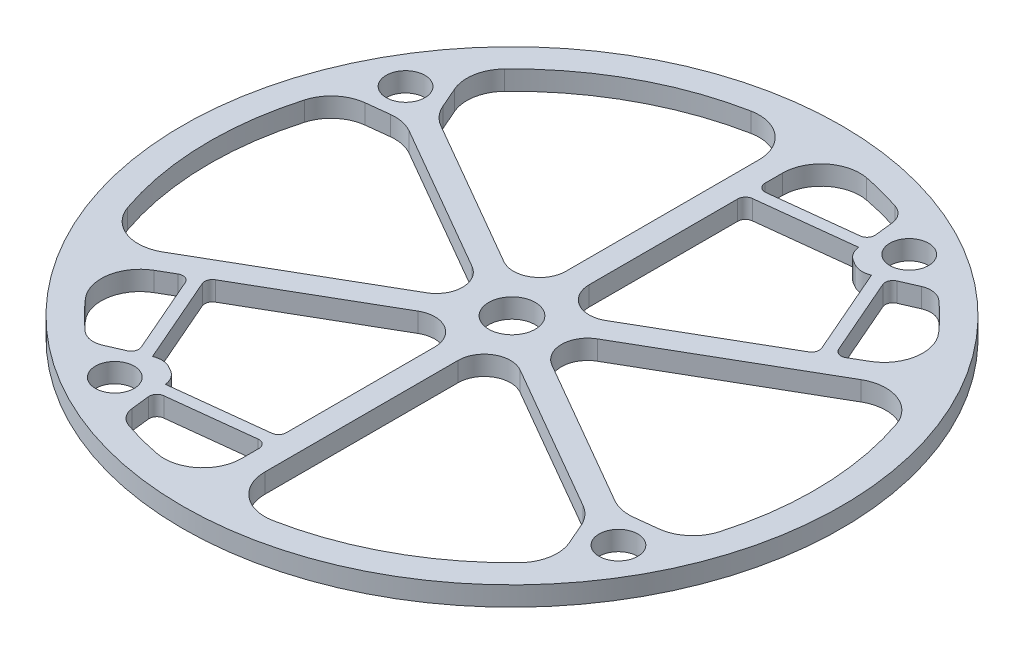
from build123d import *

# Parameters (mm, degrees)
SZKIC1_R                    = 85
DODANIE_WYCI_GNI_CIE1_DEPTH = 5
SZKIC2_R                    = 5
SZKIC2_R_2                  = 6
WYTNIJ_WYCI_GNI_CIE2_DEPTH  = 5
ZAOKR_GLENIE2_R             = 10
ZAOKR_GLENIE4_R             = 10
ZAOKR_GLENIE5_R             = 5
DODANIE_WYCI_GNI_CIE2_DEPTH = 5
ZAOKR_GLENIE6_R             = 2


with BuildPart() as part:
    # Szkic1 → Dodanie-wyciągnięcie1 (new body)
    with BuildSketch(Plane(origin=(0, 0, 0), x_dir=(1, 0, 0), z_dir=(0, 1, 0))):
        with Locations(Location((0, 0, 0), (0, 0, 270))):
            Circle(SZKIC1_R)
    extrude(amount=DODANIE_WYCI_GNI_CIE1_DEPTH)

    # Szkic2 → Wytnij-wyciągnięcie2 (cut)
    with BuildSketch(Plane(origin=(0, 5, 0), x_dir=(1, 0, 0), z_dir=(0, 1, 0))):
        with BuildLine():
            Line((3, 77.942286341), (3, 16.907164233))
            ThreePointArc((3, 16.907164233), (6.38067791, 11.051658328), (13.142033731, 11.051658328))
            Line((13.142033731, 11.051658328), (66, 41.569219382))
            ThreePointArc((66, 41.569219382), (58.334842927, 51.778819035), (49.106893514, 60.601262441))
            Line((49.106893514, 60.601262441), (34.87960923, 54.413255334))
            ThreePointArc((34.87960923, 54.413255334), (32.316363874, 55.973584145), (29.683456807, 57.413255334))
            Line((29.683456807, 57.413255334), (27.928786019, 72.828448504))
            ThreePointArc((27.928786019, 72.828448504), (15.674351199, 76.408865418), (3, 77.942286341))
        make_face()
        with BuildLine():
            ThreePointArc((-13.142033731, 11.051658328), (-6.38067791, 11.051658328), (-3, 16.907164233))
            Line((-3, 16.907164233), (-3, 77.942286341))
            ThreePointArc((-3, 77.942286341), (-34.916330218, 69.748475855), (-60.601262441, 49.106893514))
            Line((-60.601262441, 49.106893514), (-54.413255334, 34.87960923))
            Line((-54.413255334, 34.87960923), (-13.142033731, 11.051658328))
        make_face()
        with BuildLine():
            Line((69, 36.373066959), (16.142033731, 5.855505905))
            ThreePointArc((16.142033731, 5.855505905), (12.761355821, 0), (16.142033731, -5.855505905))
            Line((16.142033731, -5.855505905), (57.413255334, -29.683456807))
            Line((57.413255334, -29.683456807), (72.828448504, -27.928786019))
            ThreePointArc((72.828448504, -27.928786019), (77.862117075, 4.635808952), (69, 36.373066959))
        make_face()
        with BuildLine():
            ThreePointArc((-16.142033731, -5.855505905), (-12.761355821, 0), (-16.142033731, 5.855505905))
            Line((-16.142033731, 5.855505905), (-57.413255334, 29.683456807))
            Line((-57.413255334, 29.683456807), (-72.828448504, 27.928786019))
            ThreePointArc((-72.828448504, 27.928786019), (-77.862117075, -4.635808952), (-69, -36.373066959))
            Line((-69, -36.373066959), (-16.142033731, -5.855505905))
        make_face()
        with BuildLine():
            ThreePointArc((-62.987803669, 32.901923789), (-60.621778265, 35), (-59.987803669, 38.098076211))
            ThreePointArc((-59.987803669, 38.098076211), (-69.282032303, 40), (-62.987803669, 32.901923789))
        make_face()
        with BuildLine():
            ThreePointArc((59.987803669, -38.098076211), (69.282032303, -40), (62.987803669, -32.901923789))
            ThreePointArc((62.987803669, -32.901923789), (60.621778265, -35), (59.987803669, -38.098076211))
        make_face()
        with BuildLine():
            Line((60.601262441, -49.106893514), (54.413255334, -34.87960923))
            Line((54.413255334, -34.87960923), (13.142033731, -11.051658328))
            ThreePointArc((13.142033731, -11.051658328), (6.38067791, -11.051658328), (3, -16.907164233))
            Line((3, -16.907164233), (3, -77.942286341))
            ThreePointArc((3, -77.942286341), (34.916330218, -69.748475855), (60.601262441, -49.106893514))
        make_face()
        with BuildLine():
            ThreePointArc((-3, -16.907164233), (-6.38067791, -11.051658328), (-13.142033731, -11.051658328))
            Line((-13.142033731, -11.051658328), (-66, -41.569219382))
            ThreePointArc((-66, -41.569219382), (-58.334842927, -51.778819035), (-49.106893514, -60.601262441))
            Line((-49.106893514, -60.601262441), (-34.87960923, -54.413255334))
            ThreePointArc((-34.87960923, -54.413255334), (-32.316363874, -55.973584145), (-29.683456807, -57.413255334))
            Line((-29.683456807, -57.413255334), (-27.928786019, -72.828448504))
            ThreePointArc((-27.928786019, -72.828448504), (-15.674351199, -76.408865418), (-3, -77.942286341))
            Line((-3, -77.942286341), (-3, -16.907164233))
        make_face()
        with Locations(Location((-37.5, -64.951905284, 0), (0, 0, 270))):
            Circle(SZKIC2_R)
        with Locations(Location((37.5, 64.951905284, 0), (0, 0, 270))):
            Circle(SZKIC2_R)
        with Locations(Location((0, 0, 0), (0, 0, 270))):
            Circle(SZKIC2_R_2)
    extrude(amount=-WYTNIJ_WYCI_GNI_CIE2_DEPTH, mode=Mode.SUBTRACT)

    # Zaokrąglenie2
    zaokr_glenie2_edges = [part.edges().sort_by_distance(p)[0] for p in [
        (-60.601262441, 2.5, -49.106893514),
        (-3, 2.5, -77.942286341),
        (-69, 2.5, 36.373066959),
        (-72.828448504, 2.5, -27.928786019),
        (69, 2.5, -36.373066959),
        (72.828448504, 2.5, 27.928786019),
        (3, 2.5, -77.942286341),
        (66, 2.5, -41.569219382),
        (60.601262441, 2.5, 49.106893514),
        (3, 2.5, 77.942286341),
        (-3, 2.5, 77.942286341),
        (-66, 2.5, 41.569219382),
    ]]
    fillet(zaokr_glenie2_edges, radius=ZAOKR_GLENIE2_R)

    # Zaokrąglenie4
    zaokr_glenie4_edges = [part.edges().sort_by_distance(p)[0] for p in [
        (-54.413255334, 2.5, -34.87960923),
        (-57.413255334, 2.5, -29.683456807),
        (57.413255334, 2.5, 29.683456807),
        (54.413255334, 2.5, 34.87960923),
    ]]
    fillet(zaokr_glenie4_edges, radius=ZAOKR_GLENIE4_R)

    # Zaokrąglenie5
    zaokr_glenie5_edges = [part.edges().sort_by_distance(p)[0] for p in [
        (27.928786019, 2.5, -72.828448504),
        (29.683456807, 2.5, -57.413255334),
        (34.87960923, 2.5, -54.413255334),
        (49.106893514, 2.5, -60.601262441),
        (-27.928786019, 2.5, 72.828448504),
        (-29.683456807, 2.5, 57.413255334),
        (-34.87960923, 2.5, 54.413255334),
        (-49.106893514, 2.5, 60.601262441),
    ]]
    fillet(zaokr_glenie5_edges, radius=ZAOKR_GLENIE5_R)

    # Szkic3 → Dodanie-wyciągnięcie2 (add, through all)
    with BuildSketch(Plane(origin=(0, 5, 0), x_dir=(1, 0, 0), z_dir=(0, 1, 0))):
        Polygon((3, 57), (29.388588378, 60.003743428), (29.049297257, 62.984495269), (3, 60.019372454), align=None)
        Polygon((40.021524319, 56.649677021), (37.270471942, 55.453135831), (47.863448016, 31.098076211), (50.478301265, 32.607762438), align=None)
        Polygon((-47.863448016, -31.098076211), (-37.270471942, -55.453135831), (-40.021524319, -56.649677021), (-50.478301265, -32.607762438), align=None)
        Polygon((-3, -60.019372454), (-3, -57), (-29.388588378, -60.003743428), (-29.049297257, -62.984495269), align=None)
    extrude(amount=-DODANIE_WYCI_GNI_CIE2_DEPTH)

    # Zaokrąglenie6
    zaokr_glenie6_edges = [part.edges().sort_by_distance(p)[0] for p in [
        (3, 2.5, -57),
        (3, 2.5, -60.019372454),
        (29.049297257, 2.5, -62.984495269),
        (40.021524319, 2.5, -56.649677021),
        (50.478301265, 2.5, -32.607762438),
        (47.863448016, 2.5, -31.098076211),
        (-50.478301265, 2.5, 32.607762438),
        (-47.863448016, 2.5, 31.098076211),
        (-40.021524319, 2.5, 56.649677021),
        (-3, 2.5, 60.019372454),
        (-29.049297257, 2.5, 62.984495269),
        (-3, 2.5, 57),
    ]]
    fillet(zaokr_glenie6_edges, radius=ZAOKR_GLENIE6_R)


solid = part.part
